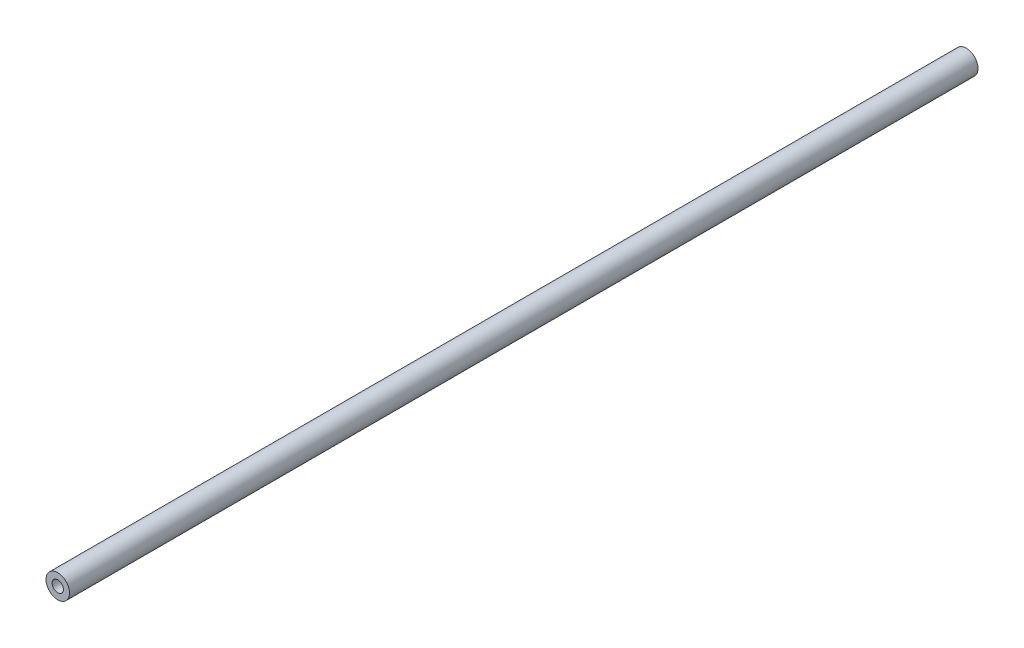
from build123d import *

# Parameters (mm, degrees)
SKETCH1_R           = 0.3175
SKETCH1_R_2         = 0.1524
BOSS_EXTRUDE1_DEPTH = 24.511


with BuildPart() as part:
    # Sketch1 → Boss-Extrude1 (new body)
    with BuildSketch(Plane.XY):
        Circle(SKETCH1_R)
        Circle(SKETCH1_R_2, mode=Mode.SUBTRACT)
    extrude(amount=BOSS_EXTRUDE1_DEPTH)


solid = part.part
